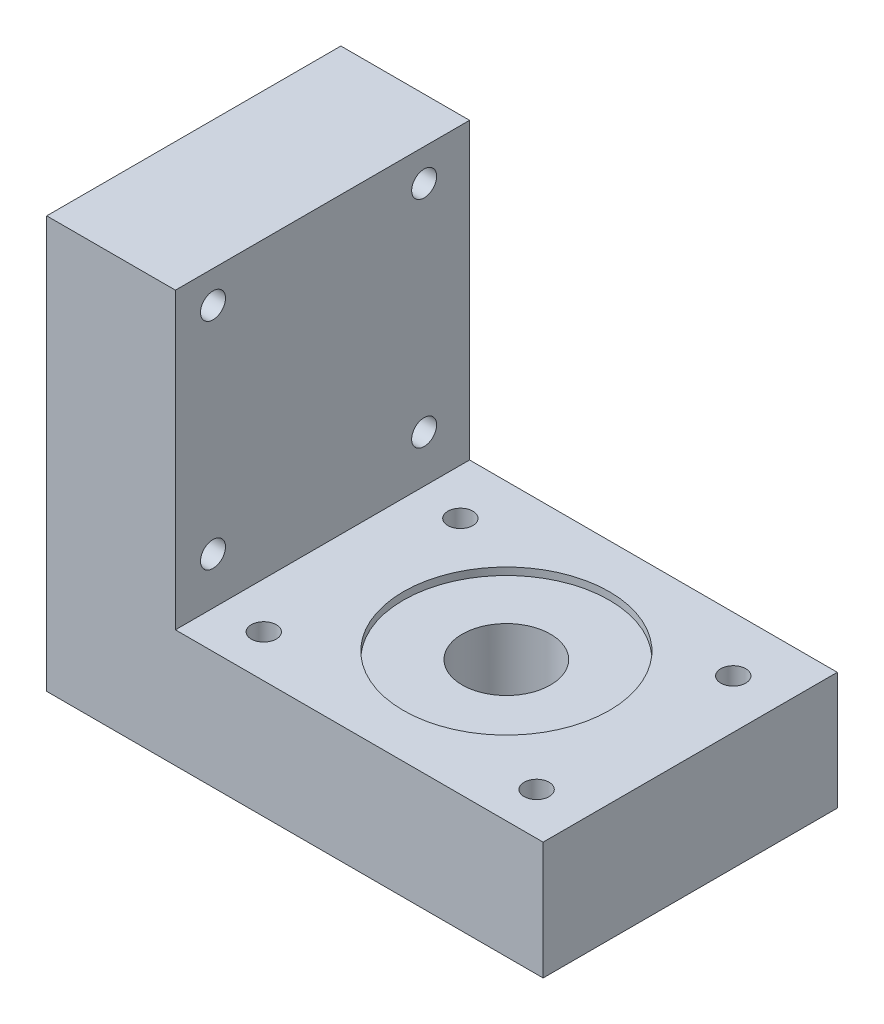
from build123d import *

# Parameters (mm, degrees)
BOSS_EXTRUDE1_DEPTH = 40000
SKETCH3_R           = 6000
SKETCH3_R_2         = 1700
CUT_EXTRUDE1_DEPTH  = 16000
SKETCH4_R           = 1700
CUT_EXTRUDE2_DEPTH  = 17500
SKETCH5_R           = 14000
CUT_EXTRUDE3_DEPTH  = 1000


with BuildPart() as part:
    # Sketch2 → Boss-Extrude1 (new body)
    with BuildSketch(Plane.XY):
        Polygon((0, 56000), (0, 0), (67500, 0), (67500, 16000), (17500, 16000), (17500, 56000), align=None)
    extrude(amount=BOSS_EXTRUDE1_DEPTH)

    # Sketch3 → Cut-Extrude1 (cut)
    with BuildSketch(Plane(origin=(0, 16000, 0), x_dir=(1, 0, 0), z_dir=(0, 1, 0))):
        with Locations(Location((42500, -20000, 0), (0, 0, 270))):
            Circle(SKETCH3_R)
        with Locations(Location((23750, -7500, 0), (0, 0, 270))):
            Circle(SKETCH3_R_2)
        with Locations(Location((60851.273434081, -7500, 0), (0, 0, 270))):
            Circle(SKETCH3_R_2)
        with Locations(Location((60851.273434081, -34236.081124855, 0), (0, 0, 270))):
            Circle(SKETCH3_R_2)
        with Locations(Location((23750, -34236.081124855, 0), (0, 0, 270))):
            Circle(SKETCH3_R_2)
    extrude(amount=-CUT_EXTRUDE1_DEPTH, mode=Mode.SUBTRACT)

    # Sketch4 → Cut-Extrude2 (cut)
    with BuildSketch(Plane(origin=(17500, 0, 0), x_dir=(0, 0, -1), z_dir=(1, 0, 0))):
        with Locations(Location((-34887.583341657, 51657.39458708, 0), (0, 0, 90))):
            Circle(SKETCH4_R)
        with Locations(Location((-6177.404587566, 51657.39458708, 0), (0, 0, 90))):
            Circle(SKETCH4_R)
        with Locations(Location((-34887.583341657, 22377.158132096, 0), (0, 0, 90))):
            Circle(SKETCH4_R)
        with Locations(Location((-6177.404587566, 22377.158132096, 0), (0, 0, 90))):
            Circle(SKETCH4_R)
    extrude(amount=-CUT_EXTRUDE2_DEPTH, mode=Mode.SUBTRACT)

    # Sketch5 → Cut-Extrude3 (cut)
    with BuildSketch(Plane(origin=(0, 16000, 0), x_dir=(1, 0, 0), z_dir=(0, 1, 0))):
        with Locations(Location((42500, -20000, 0), (0, 0, 180))):
            Circle(SKETCH5_R)
    extrude(amount=-CUT_EXTRUDE3_DEPTH, mode=Mode.SUBTRACT)


solid = part.part
